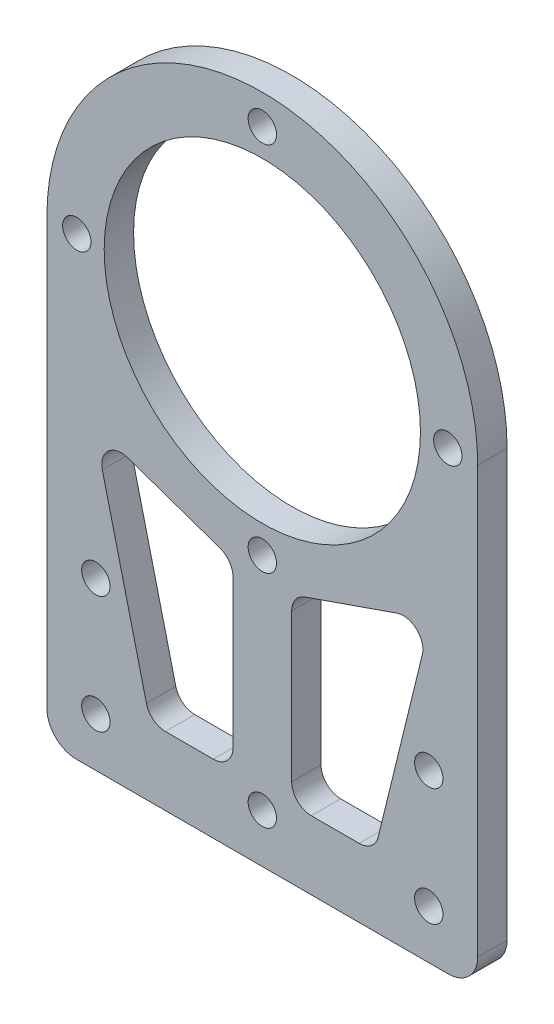
from build123d import *

# Parameters (mm, degrees)
SKETCH_1_R          = 16.15
EXTRUDE_1_DEPTH     = 3
SKETCH_2_R          = 1.45
CUT_EXTRUDE_1_DEPTH = 5
FILLET_1_R          = 3
CUT_EXTRUDE_2_DEPTH = 52.529117982
FILLET_2_R          = 2


with BuildPart() as part:
    # 草图1 → 凸台-拉伸1 (new body)
    with BuildSketch(Plane.XY):
        with BuildLine():
            Line((-22, 0), (-22, -46.5))
            Line((-22, -46.5), (22, -46.5))
            Line((22, -46.5), (22, 0))
            ThreePointArc((22, 0), (0, 22), (-22, 0))
        make_face()
        Circle(SKETCH_1_R, mode=Mode.SUBTRACT)
    extrude(amount=EXTRUDE_1_DEPTH)

    # 草图2 → 切除-拉伸1 (cut)
    with BuildSketch(Plane.XY.offset(3)):
        with Locations((0, -41.5)):
            Circle(SKETCH_2_R)
        with Locations((17, -41.5)):
            Circle(SKETCH_2_R)
        with Locations((-17, -41.5)):
            Circle(SKETCH_2_R)
        with Locations((0, 18.95)):
            Circle(SKETCH_2_R)
        with Locations((18.95, 0)):
            Circle(SKETCH_2_R)
        with Locations((0, -18.95)):
            Circle(SKETCH_2_R)
        with Locations((-18.95, 0)):
            Circle(SKETCH_2_R)
        with Locations((-17, -29.5)):
            Circle(SKETCH_2_R)
        with Locations((17, -29.5)):
            Circle(SKETCH_2_R)
    extrude(amount=-CUT_EXTRUDE_1_DEPTH, mode=Mode.SUBTRACT)

    # 圆角1
    fillet_1_edges = [part.edges().sort_by_distance(p)[0] for p in [
        (22, -46.5, 1.5),
        (-22, -46.5, 1.5),
    ]]
    fillet(fillet_1_edges, radius=FILLET_1_R)

    # 草图3 → 切除-拉伸2 (cut, through all)
    with BuildSketch(Plane(origin=(0, 0, 0), x_dir=(-1, 0, 0), z_dir=(0, 0, -1))):
        Polygon((-17.217121795, -16.002095348), (-3, -20.95), (-3, -39.5), (-11.462229393, -39.5), align=None)
        Polygon((17.217121795, -16.002095348), (3, -20.95), (3, -39.5), (11.462229393, -39.5), align=None)
    extrude(amount=-CUT_EXTRUDE_2_DEPTH, mode=Mode.SUBTRACT)

    # 圆角2
    fillet_2_edges = [part.edges().sort_by_distance(p)[0] for p in [
        (11.462229393, -39.5, 1.5),
        (17.217121795, -16.002095348, 1.5),
        (3, -20.95, 1.5),
        (3, -39.5, 1.5),
        (-3, -39.5, 1.5),
        (-3, -20.95, 1.5),
        (-17.217121795, -16.002095348, 1.5),
        (-11.462229393, -39.5, 1.5),
    ]]
    fillet(fillet_2_edges, radius=FILLET_2_R)


solid = part.part
